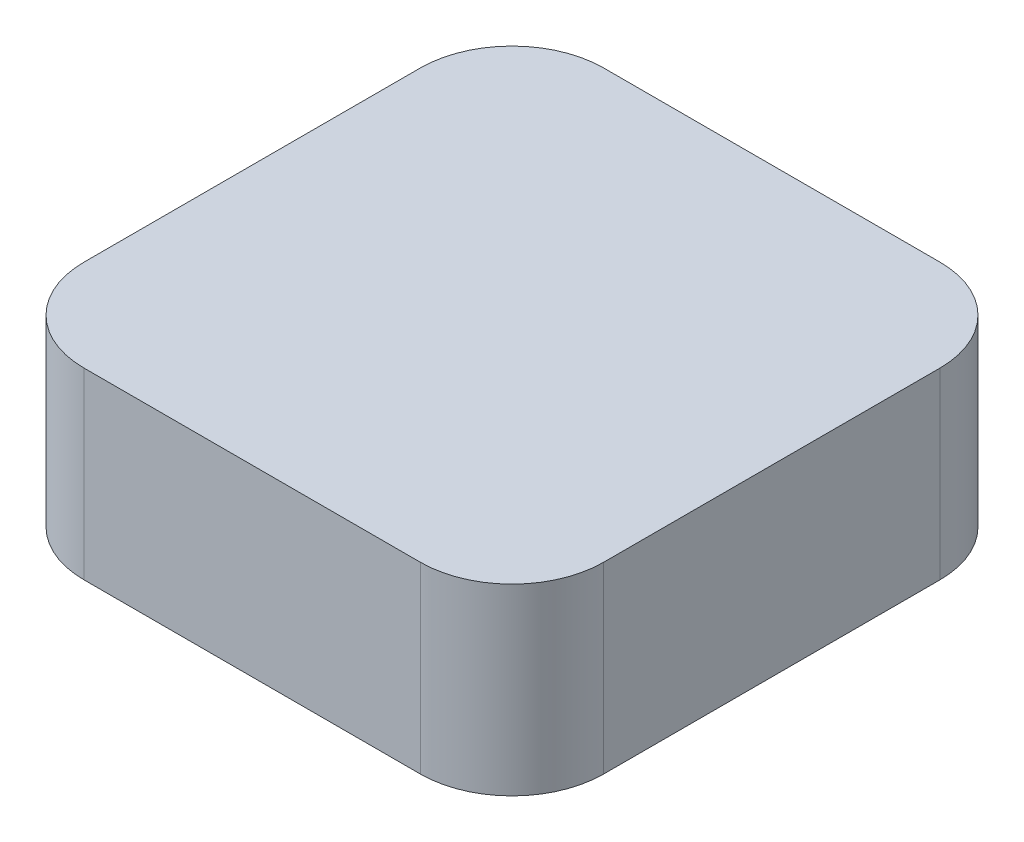
from build123d import *

# Parameters (mm, degrees)
CAP_START         = 74
CAP_DEPTH         = 6
STEM_START        = 73.8
STEM_SOCKET_DEPTH = 3.2


with BuildPart() as part:
    # Sketch1 → Cap (new body)
    with BuildSketch(Plane(origin=(0, 0, 0), x_dir=(1, 0, 0), z_dir=(0, 1, 0)).offset(CAP_START)):
        with BuildLine():
            Line((-5.5, 90), (5.5, 90))
            ThreePointArc((5.5, 90), (7.621320344, 89.121320344), (8.5, 87))
            Line((8.5, 87), (8.5, 76))
            ThreePointArc((8.5, 76), (7.621320344, 73.878679656), (5.5, 73))
            Line((5.5, 73), (-5.5, 73))
            ThreePointArc((-5.5, 73), (-7.621320344, 73.878679656), (-8.5, 76))
            Line((-8.5, 76), (-8.5, 87))
            ThreePointArc((-8.5, 87), (-7.621320344, 89.121320344), (-5.5, 90))
        make_face()
    extrude(amount=CAP_DEPTH)

    # Sketch2 → Stem socket (cut)
    with BuildSketch(Plane(origin=(0, 0, 0), x_dir=(1, 0, 0), z_dir=(0, 1, 0)).offset(STEM_START)):
        with BuildLine():
            Line((-3.3, 85.2), (3.3, 85.2))
            ThreePointArc((3.3, 85.2), (3.582842712, 85.082842712), (3.7, 84.8))
            Line((3.7, 84.8), (3.7, 78.2))
            ThreePointArc((3.7, 78.2), (3.582842712, 77.917157288), (3.3, 77.8))
            Line((3.3, 77.8), (-3.3, 77.8))
            ThreePointArc((-3.3, 77.8), (-3.582842712, 77.917157288), (-3.7, 78.2))
            Line((-3.7, 78.2), (-3.7, 84.8))
            ThreePointArc((-3.7, 84.8), (-3.582842712, 85.082842712), (-3.3, 85.2))
        make_face()
    extrude(amount=STEM_SOCKET_DEPTH, mode=Mode.SUBTRACT)


solid = part.part
